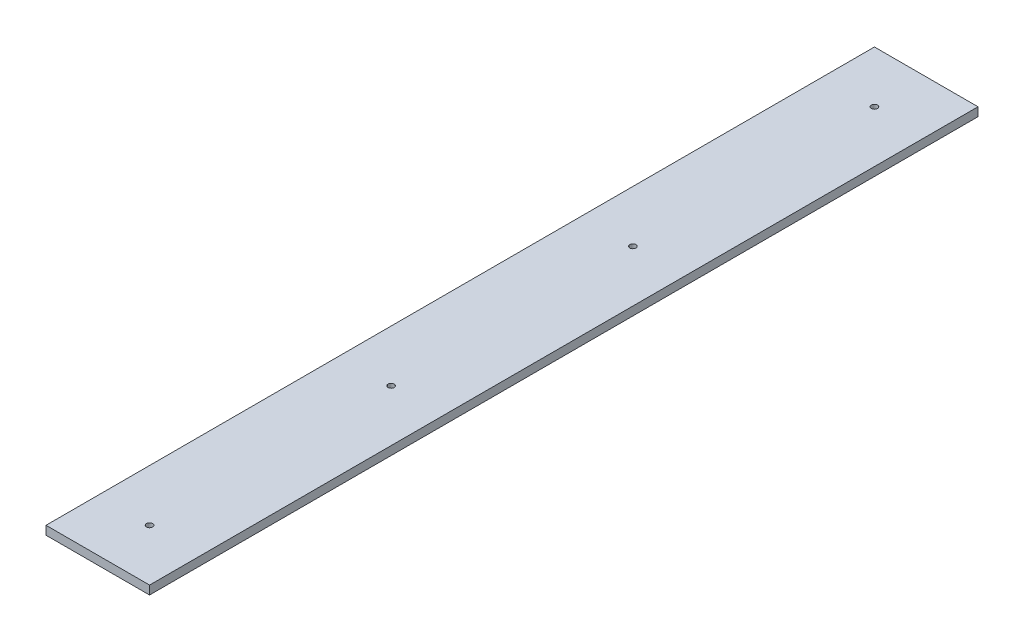
from build123d import *

# Parameters (mm, degrees)
SKETCH1_W                   = 76.2
SKETCH1_H                   = 609.6
BOSS_EXTRUDE1_DEPTH         = 6.35
F_16_0_177_DIAMETER_HOLE1_D = 4.4958


with BuildPart() as part:
    # Sketch1 → Boss-Extrude1 (new body)
    with BuildSketch(Plane(origin=(0, 0, 0), x_dir=(1, 0, 0), z_dir=(0, 1, 0))):
        with Locations((38.1, 304.8)):
            Rectangle(SKETCH1_W, SKETCH1_H)
    extrude(amount=BOSS_EXTRUDE1_DEPTH)

    # #16 (0.177) Diameter Hole1 (through all)
    with Locations(Plane(origin=(0, 6.35, 0), x_dir=(1, 0, 0), z_dir=(0, 1, 0))):
        with Locations((38.1, 38.1), (38.1, 215.9), (38.1, 393.7), (38.1, 571.5)):
            Hole(F_16_0_177_DIAMETER_HOLE1_D / 2)


solid = part.part
